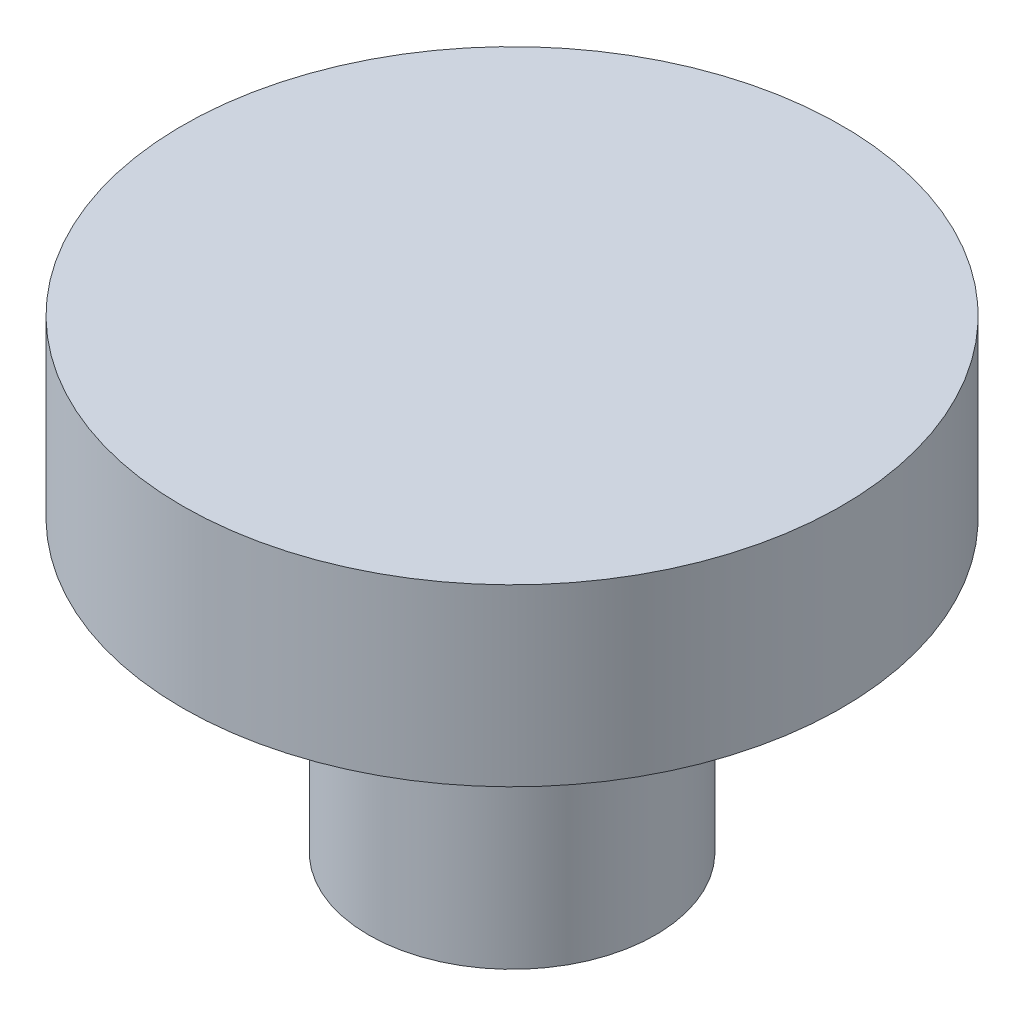
from build123d import *

# Parameters (mm, degrees)
SKETCH1_R           = 5.207
BOSS_EXTRUDE1_DEPTH = 10.5156
SKETCH2_R           = 11.9634
BOSS_EXTRUDE2_DEPTH = 6.35


with BuildPart() as part:
    # Sketch1 → Boss-Extrude1 (new body)
    with BuildSketch(Plane(origin=(0, 0, 0), x_dir=(1, 0, 0), z_dir=(0, 1, 0))):
        with Locations(Location((0, 0, 0), (0, 0, 270))):
            Circle(SKETCH1_R)
    extrude(amount=BOSS_EXTRUDE1_DEPTH)

    # Sketch2 → Boss-Extrude2 (add)
    with BuildSketch(Plane(origin=(0, 10.5156, 0), x_dir=(1, 0, 0), z_dir=(0, 1, 0))):
        with Locations(Location((0, 0, 0), (0, 0, 270))):
            Circle(SKETCH2_R)
    extrude(amount=BOSS_EXTRUDE2_DEPTH)


solid = part.part
